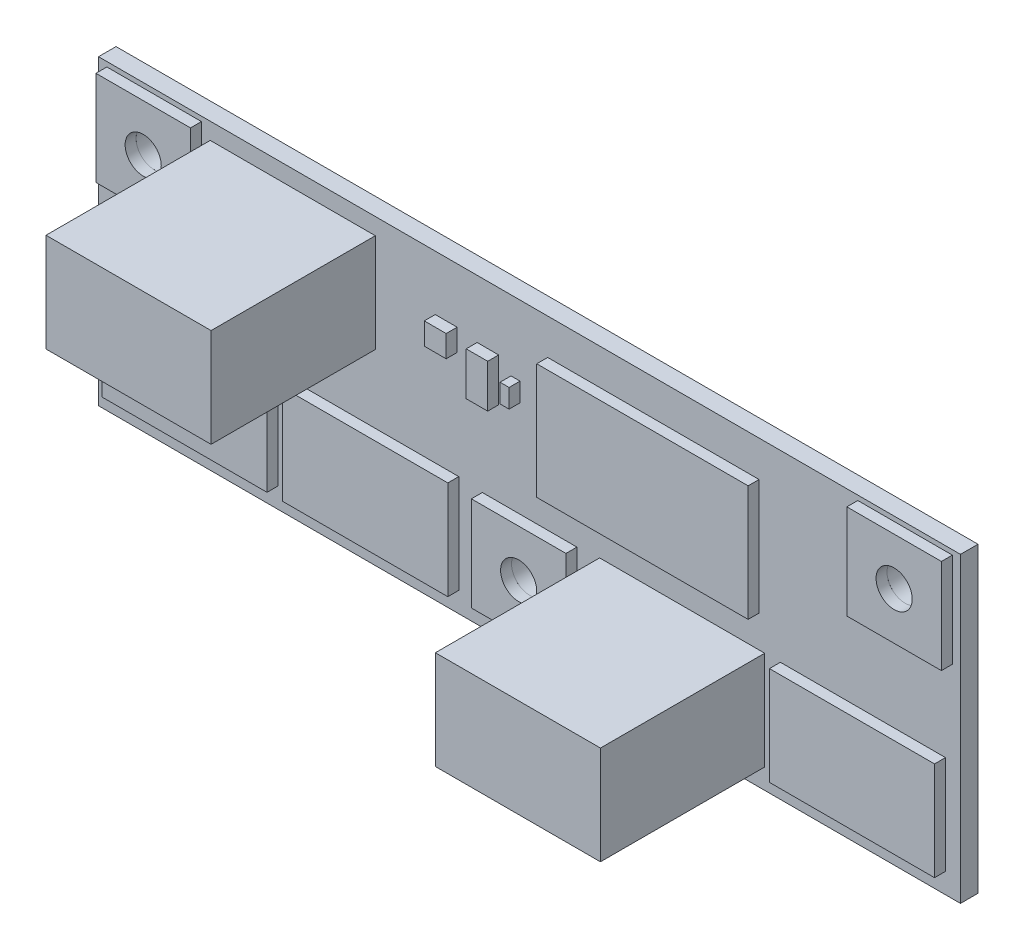
from build123d import *

# Parameters (mm, degrees)
SKETCH1_W                           = 78.72
SKETCH1_H                           = 27.61
BOARD_DEPTH                         = 1.6
SKETCH2_W                           = 0.8271
SKETCH2_H                           = 1.7161
EXTRUDE_C0402_1_DEPTH               = 1
SKETCH3_W                           = 8.636
SKETCH3_H                           = 8.636
EXTRUDE_3_3_1_DEPTH                 = 1
SKETCH4_W                           = 8.636
SKETCH4_H                           = 8.636
EXTRUDE_3_3_2_DEPTH                 = 1
SKETCH5_W                           = 8.636
SKETCH5_H                           = 8.636
EXTRUDE_3_3_3_DEPTH                 = 1
SKETCH6_W                           = 19.304
SKETCH6_H                           = 10.5664
TO220H_1_DEPTH                      = 1
SKETCH7_W                           = 1.966
SKETCH7_H                           = 3.946
EXTRUDE_R0805_1_DEPTH               = 1
SKETCH8_W                           = 15.0762
SKETCH8_H                           = 9
EXTRUDE_1935789_1_DEPTH             = 15
SKETCH9_W                           = 15.0762
SKETCH9_H                           = 9
EXTRUDE_1935789_2_DEPTH             = 1
SKETCH10_W                          = 15.0762
SKETCH10_H                          = 9
EXTRUDE_1935789_3_DEPTH             = 15
SKETCH11_W                          = 15.0762
SKETCH11_H                          = 9
EXTRUDE_1935789_4_DEPTH             = 1
SKETCH12_W                          = 2
SKETCH12_H                          = 2
F_2920L400_15MR_1_DEPTH             = 1
SKETCH13_W                          = 2
SKETCH13_H                          = 2
F_2920L400_15MR_2_DEPTH             = 1
SKETCH14_W                          = 2
SKETCH14_H                          = 2
F_2920L400_15MR_3_DEPTH             = 1
SKETCH15_W                          = 2
SKETCH15_H                          = 2
F_2920L400_15MR_4_DEPTH             = 1
SKETCH16_W                          = 15.0762
SKETCH16_H                          = 9
EXTRUDE_1935789_5_DEPTH             = 1
SKETCH17_W                          = 2
SKETCH17_H                          = 2
PDM_2019_REVB_MIC4416YM4_TR_1_DEPTH = 1
SKETCH18_R                          = 1.65
CUT_EXTRUDE1_DEPTH                  = 10.16
SKETCH19_R                          = 1.65
CUT_EXTRUDE2_DEPTH                  = 10.16
SKETCH20_R                          = 1.65
CUT_EXTRUDE3_DEPTH                  = 10.16


with BuildPart() as part:
    # Sketch1 → BOARD (new body)
    with BuildSketch(Plane.XY):
        with Locations((39.36, 13.805)):
            Rectangle(SKETCH1_W, SKETCH1_H)
    extrude(amount=BOARD_DEPTH)


with BuildPart() as body_2:
    # Sketch2 → Extrude C0402-1 (new body)
    with BuildSketch(Plane.XY.offset(1.6)):
        with Locations((38.08095, 20.33905)):
            Rectangle(SKETCH2_W, SKETCH2_H)
    extrude(amount=EXTRUDE_C0402_1_DEPTH)


with BuildPart() as body_3:
    # Sketch3 → Extrude 3_3-1 (new body)
    with BuildSketch(Plane.XY.offset(1.6)):
        with Locations((5.08, 22.86)):
            Rectangle(SKETCH3_W, SKETCH3_H)
    extrude(amount=EXTRUDE_3_3_1_DEPTH)


with BuildPart() as body_4:
    # Sketch4 → Extrude 3_3-2 (new body)
    with BuildSketch(Plane.XY.offset(1.6)):
        with Locations((73.66, 22.86)):
            Rectangle(SKETCH4_W, SKETCH4_H)
    extrude(amount=EXTRUDE_3_3_2_DEPTH)


with BuildPart() as body_5:
    # Sketch5 → Extrude 3_3-3 (new body)
    with BuildSketch(Plane.XY.offset(1.6)):
        with Locations((39.37, 6.35)):
            Rectangle(SKETCH5_W, SKETCH5_H)
    extrude(amount=EXTRUDE_3_3_3_DEPTH)


with BuildPart() as body_6:
    # Sketch6 → TO220H-1 (new body)
    with BuildSketch(Plane.XY.offset(1.6)):
        with Locations((50.673, 19.05)):
            Rectangle(SKETCH6_W, SKETCH6_H)
    extrude(amount=TO220H_1_DEPTH)


with BuildPart() as body_7:
    # Sketch7 → Extrude R0805-1 (new body)
    with BuildSketch(Plane.XY.offset(1.6)):
        with Locations((35.56, 20.32)):
            Rectangle(SKETCH7_W, SKETCH7_H)
    extrude(amount=EXTRUDE_R0805_1_DEPTH)


with BuildPart() as body_8:
    # Sketch8 → Extrude 1935789-1 (new body)
    with BuildSketch(Plane.XY.offset(1.6)):
        with Locations((17.7419, 21.59)):
            Rectangle(SKETCH8_W, SKETCH8_H)
    extrude(amount=EXTRUDE_1935789_1_DEPTH)


with BuildPart() as body_9:
    # Sketch9 → Extrude 1935789-2 (new body)
    with BuildSketch(Plane.XY.offset(1.6)):
        with Locations((25.3619, 6.35)):
            Rectangle(SKETCH9_W, SKETCH9_H)
    extrude(amount=EXTRUDE_1935789_2_DEPTH)


with BuildPart() as body_10:
    # Sketch10 → Extrude 1935789-3 (new body)
    with BuildSketch(Plane.XY.offset(1.6)):
        with Locations((53.3019, 6.35)):
            Rectangle(SKETCH10_W, SKETCH10_H)
    extrude(amount=EXTRUDE_1935789_3_DEPTH)


with BuildPart() as body_11:
    # Sketch11 → Extrude 1935789-4 (new body)
    with BuildSketch(Plane.XY.offset(1.6)):
        with Locations((8.8519, 6.35)):
            Rectangle(SKETCH11_W, SKETCH11_H)
    extrude(amount=EXTRUDE_1935789_4_DEPTH)


with BuildPart() as body_12:
    # Sketch12 → 2920L400_15MR-1 (new body)
    with BuildSketch(Plane.XY):
        with Locations((20.32, 16.51)):
            Rectangle(SKETCH12_W, SKETCH12_H)
    extrude(amount=-F_2920L400_15MR_1_DEPTH)


with BuildPart() as body_13:
    # Sketch13 → 2920L400_15MR-2 (new body)
    with BuildSketch(Plane.XY):
        with Locations((48.26, 16.51)):
            Rectangle(SKETCH13_W, SKETCH13_H)
    extrude(amount=-F_2920L400_15MR_2_DEPTH)


with BuildPart() as body_14:
    # Sketch14 → 2920L400_15MR-3 (new body)
    with BuildSketch(Plane.XY):
        with Locations((3.81, 16.51)):
            Rectangle(SKETCH14_W, SKETCH14_H)
    extrude(amount=-F_2920L400_15MR_3_DEPTH)


with BuildPart() as body_15:
    # Sketch15 → 2920L400_15MR-4 (new body)
    with BuildSketch(Plane.XY):
        with Locations((64.77, 16.51)):
            Rectangle(SKETCH15_W, SKETCH15_H)
    extrude(amount=-F_2920L400_15MR_4_DEPTH)


with BuildPart() as body_16:
    # Sketch16 → Extrude 1935789-5 (new body)
    with BuildSketch(Plane.XY.offset(1.6)):
        with Locations((69.8119, 6.35)):
            Rectangle(SKETCH16_W, SKETCH16_H)
    extrude(amount=EXTRUDE_1935789_5_DEPTH)


with BuildPart() as body_17:
    # Sketch17 → PDM_2019_REVB_MIC4416YM4-TR-1 (new body)
    with BuildSketch(Plane.XY.offset(1.6)):
        with Locations((31.75, 21.59)):
            Rectangle(SKETCH17_W, SKETCH17_H)
    extrude(amount=PDM_2019_REVB_MIC4416YM4_TR_1_DEPTH)


with BuildPart() as cut_extrude1_tool:
    # Sketch18 → Cut-Extrude1 (new body)
    with BuildSketch(Plane.XY.offset(2.6)):
        with Locations((5.08, 22.86)):
            Circle(SKETCH18_R)
    extrude(amount=-CUT_EXTRUDE1_DEPTH)


with BuildPart() as part_1:
    add(part.part)

    # Cut-Extrude1: cut by cut_extrude1_tool
    add(cut_extrude1_tool.part, mode=Mode.SUBTRACT)


with BuildPart() as body_3_1:
    add(body_3.part)

    # Cut-Extrude1: cut by cut_extrude1_tool
    add(cut_extrude1_tool.part, mode=Mode.SUBTRACT)


with BuildPart() as cut_extrude2_tool:
    # Sketch19 → Cut-Extrude2 (new body)
    with BuildSketch(Plane.XY.offset(2.6)):
        with Locations((39.37, 6.35)):
            Circle(SKETCH19_R)
    extrude(amount=-CUT_EXTRUDE2_DEPTH)


with BuildPart() as part_2:
    add(part_1.part)

    # Cut-Extrude2: cut by cut_extrude2_tool
    add(cut_extrude2_tool.part, mode=Mode.SUBTRACT)


with BuildPart() as body_5_1:
    add(body_5.part)

    # Cut-Extrude2: cut by cut_extrude2_tool
    add(cut_extrude2_tool.part, mode=Mode.SUBTRACT)


with BuildPart() as cut_extrude3_tool:
    # Sketch20 → Cut-Extrude3 (new body)
    with BuildSketch(Plane.XY.offset(2.6)):
        with Locations((73.66, 22.86)):
            Circle(SKETCH20_R)
    extrude(amount=-CUT_EXTRUDE3_DEPTH)


with BuildPart() as part_3:
    add(part_2.part)

    # Cut-Extrude3: cut by cut_extrude3_tool
    add(cut_extrude3_tool.part, mode=Mode.SUBTRACT)


with BuildPart() as body_4_1:
    add(body_4.part)

    # Cut-Extrude3: cut by cut_extrude3_tool
    add(cut_extrude3_tool.part, mode=Mode.SUBTRACT)


solid = Compound([body_2.part, body_6.part, body_7.part, body_8.part, body_9.part, body_10.part, body_11.part, body_12.part, body_13.part, body_14.part, body_15.part, body_16.part, body_17.part, body_3_1.part, body_5_1.part, part_3.part, body_4_1.part])
